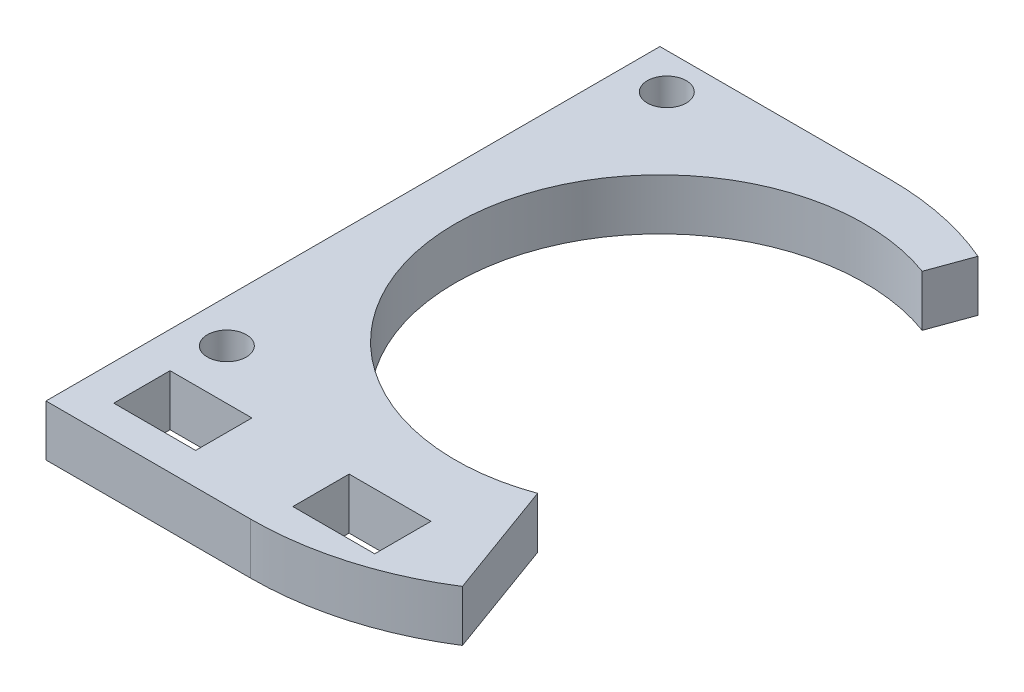
from build123d import *

# Parameters (mm, degrees)
CROQUIS1_R              = 8
CROQUIS1_R_2            = 0.76
CROQUIS1_W              = 3.2
CROQUIS1_H              = 2.2
SALIENTE_EXTRUIR1_DEPTH = 2
CORTAR_EXTRUIR1_START   = -10
CORTAR_EXTRUIR1_DEPTH   = 10


with BuildPart() as part:
    # Croquis1 → Saliente-Extruir1 (new body)
    with BuildSketch(Plane(origin=(0, 0, 0), x_dir=(1, 0, 0), z_dir=(0, 1, 0))):
        with BuildLine():
            Line((0, 0), (8, 0))
            ThreePointArc((8, 0), (16.485281374, 3.514718626), (20, 12))
            Line((20, 12), (20, 13))
            ThreePointArc((20, 13), (16.778174593, 20.778174593), (9, 24))
            Line((9, 24), (0, 24))
            Line((0, 24), (0, 0))
        make_face()
        with Locations(Location((10, 14, 0), (0, 0, 270))):
            Circle(CROQUIS1_R, mode=Mode.SUBTRACT)
        with Locations(Location((1.67, 22.6, 0), (0, 0, 270))):
            Circle(CROQUIS1_R_2, mode=Mode.SUBTRACT)
        with Locations(Location((1.67, 5.4, 0), (0, 0, 90))):
            Circle(CROQUIS1_R_2, mode=Mode.SUBTRACT)
        with Locations((10, 2.35)):
            Rectangle(CROQUIS1_W, CROQUIS1_H, mode=Mode.SUBTRACT)
        with Locations((3, 2.35)):
            Rectangle(CROQUIS1_W, CROQUIS1_H, mode=Mode.SUBTRACT)
    extrude(amount=SALIENTE_EXTRUIR1_DEPTH)

    # Croquis2 → Cortar-Extruir1 (cut)
    with BuildSketch(Plane(origin=(0, 2, 0), x_dir=(1, 0, 0), z_dir=(0, 1, 0)).offset(CORTAR_EXTRUIR1_START)):
        with BuildLine():
            Line((14.418335952, 26.139278259), (12.736161147, 21.517540966))
            ThreePointArc((12.736161147, 21.517540966), (18, 14), (12.736161147, 6.482459034))
            Line((12.736161147, 6.482459034), (14.418335952, 1.860721741))
            ThreePointArc((14.418335952, 1.860721741), (22.918350097, 14), (14.418335952, 26.139278259))
        make_face()
    extrude(amount=CORTAR_EXTRUIR1_DEPTH, mode=Mode.SUBTRACT)


solid = part.part
